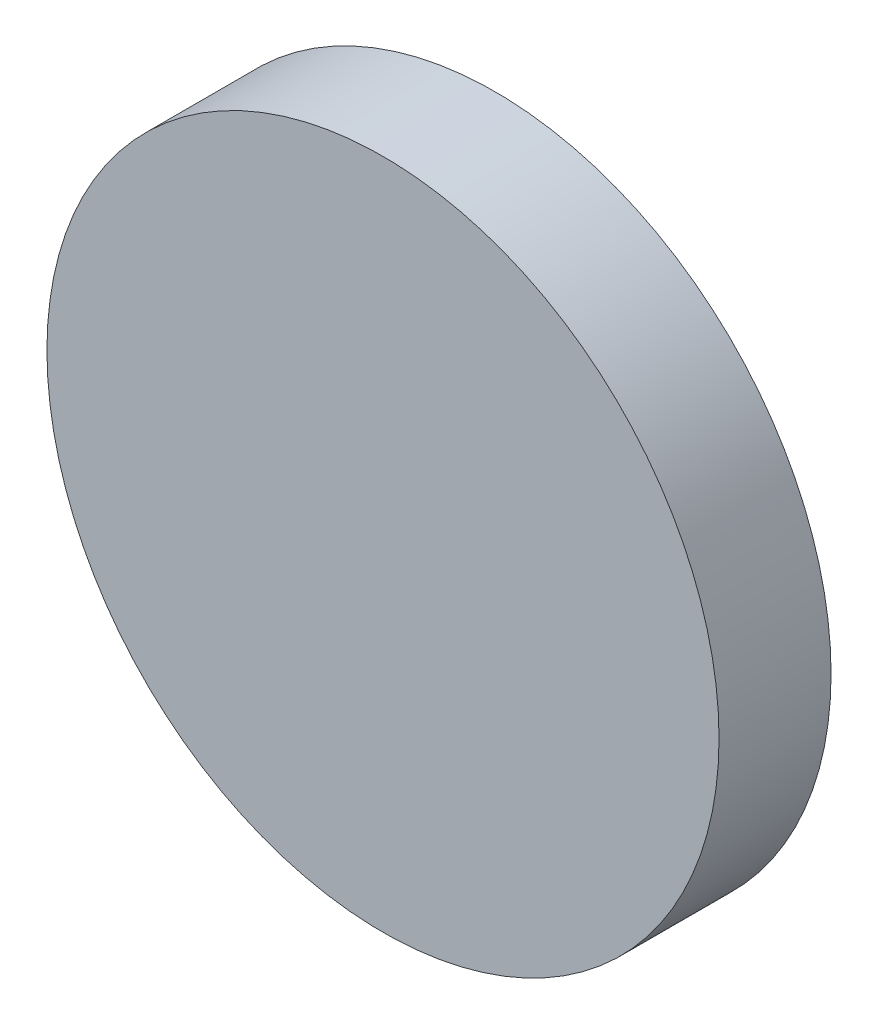
from build123d import *

# Parameters (mm, degrees)
SCHIZZO1_R                   = 150
ESTRUSIONE_ESTRUSIONE1_DEPTH = 50


with BuildPart() as part:
    # Schizzo1 → Estrusione-Estrusione1 (new body)
    with BuildSketch(Plane.XY):
        Circle(SCHIZZO1_R)
    extrude(amount=-ESTRUSIONE_ESTRUSIONE1_DEPTH)


solid = part.part
